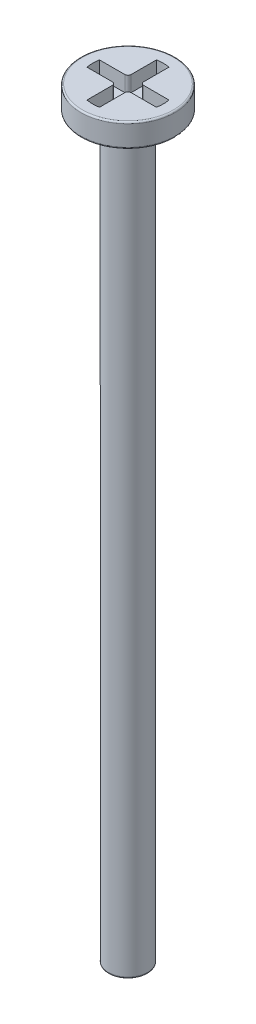
from build123d import *

# Parameters (mm, degrees)
FILLET1_R          = 0.1
CUT_EXTRUDE1_DEPTH = 1


with BuildPart() as part:
    # Sketch1 → Revolve1 (revolve)
    with BuildSketch(Plane.XY, mode=Mode.PRIVATE) as revolve1_sk:
        Polygon((0, 0), (-3, 0), (-3, -1.5), (-1.25, -1.5), (-1.25, -48.5), (0, -48.5), align=None)
    revolve(revolve1_sk.sketch.rotate(Axis((0, 14.912855268, 0), (0, -1, 0)), 270), axis=Axis((0, 14.912855268, 0), (0, -1, 0)))

    # Fillet1
    fillet1_edges = [part.edges().sort_by_distance(p)[0] for p in [
        (0, -48.5, -1.25),
        (0, -1.5, -3),
        (0, 0, -3),
    ]]
    fillet(fillet1_edges, radius=FILLET1_R)

    # Sketch2 → Cut-Extrude1 (cut)
    with BuildSketch(Plane(origin=(0, 0, 0), x_dir=(1, 0, 0), z_dir=(0, 1, 0))):
        with BuildLine():
            Line((-2.214158983, -0.4), (-0.6, -0.4))
            ThreePointArc((-0.6, -0.4), (-0.458578644, -0.458578644), (-0.4, -0.6))
            Line((-0.4, -0.6), (-0.4, -2.214158983))
            ThreePointArc((-0.4, -2.214158983), (0, -2.25), (0.4, -2.214158983))
            Line((0.4, -2.214158983), (0.4, -0.6))
            ThreePointArc((0.4, -0.6), (0.458578644, -0.458578644), (0.6, -0.4))
            Line((0.6, -0.4), (2.214158983, -0.4))
            ThreePointArc((2.214158983, -0.4), (2.25, 0), (2.214158983, 0.4))
            Line((2.214158983, 0.4), (0.6, 0.4))
            ThreePointArc((0.6, 0.4), (0.458578644, 0.458578644), (0.4, 0.6))
            Line((0.4, 0.6), (0.4, 2.214158983))
            ThreePointArc((0.4, 2.214158983), (0, 2.25), (-0.4, 2.214158983))
            Line((-0.4, 2.214158983), (-0.4, 0.6))
            ThreePointArc((-0.4, 0.6), (-0.458578644, 0.458578644), (-0.6, 0.4))
            Line((-0.6, 0.4), (-2.214158983, 0.4))
            ThreePointArc((-2.214158983, 0.4), (-2.25, 0), (-2.214158983, -0.4))
        make_face()
    extrude(amount=-CUT_EXTRUDE1_DEPTH, mode=Mode.SUBTRACT)


solid = part.part
